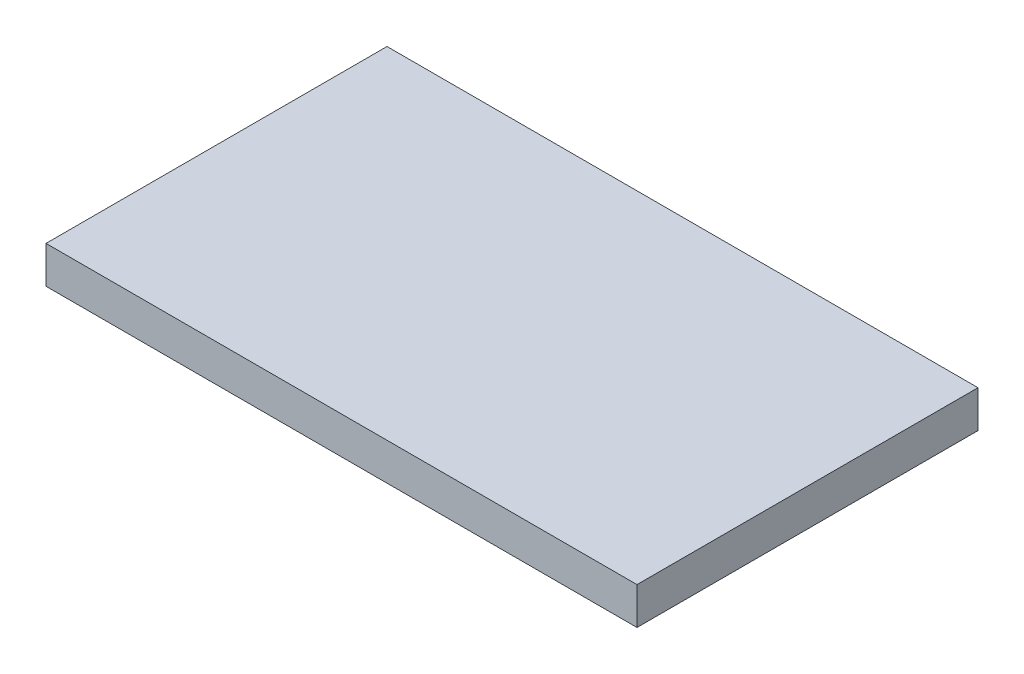
from build123d import *

# Parameters (mm, degrees)
SKETCH1_W           = 129.244162528
SKETCH1_H           = 74.576918848
BOSS_EXTRUDE1_DEPTH = 8.128


with BuildPart() as part:
    # Sketch1 → Boss-Extrude1 (new body)
    with BuildSketch(Plane(origin=(0, 0, 0), x_dir=(1, 0, 0), z_dir=(0, 1, 0))):
        Rectangle(SKETCH1_W, SKETCH1_H)
    extrude(amount=BOSS_EXTRUDE1_DEPTH)


solid = part.part
